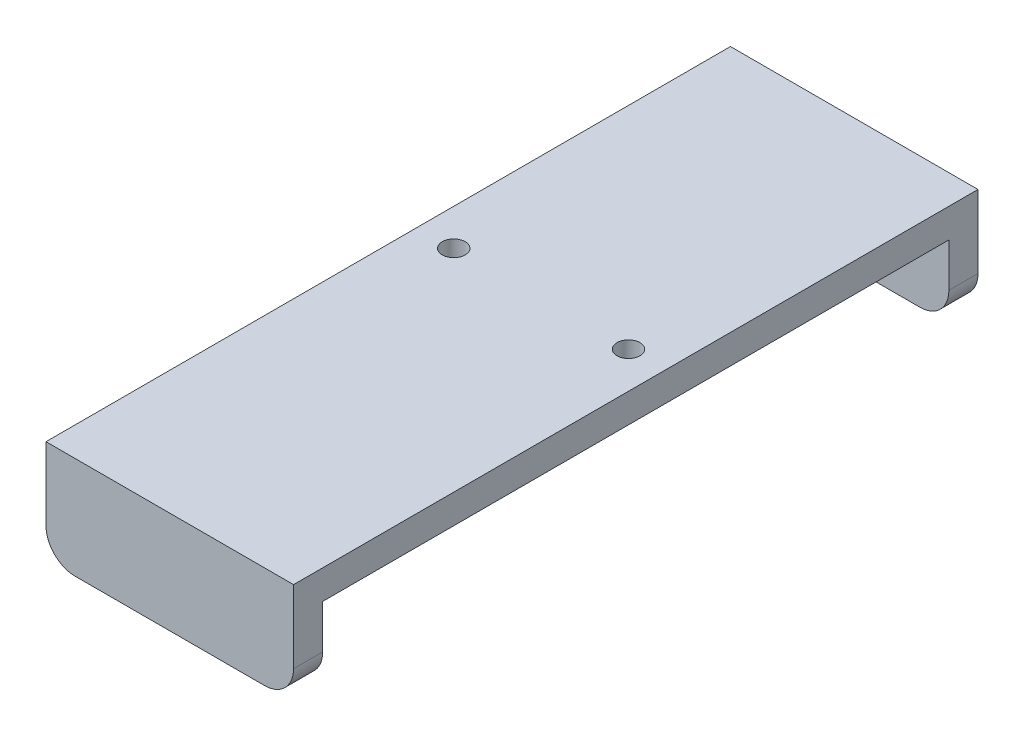
from build123d import *

# Parameters (mm, degrees)
EXTRUDE_THIN1_DEPTH = 21.59
CUT_EXTRUDE1_REACH  = 39.893
SKETCH2_R           = 1
FILLET1_R           = 2.54


with BuildPart() as part:
    # Sketch1 → Extrude-Thin1 (new body)
    with BuildSketch(Plane(origin=(0, 0, 0), x_dir=(0, 0, -1), z_dir=(1, 0, 0))):
        Polygon((-27.305, -6.35), (-27.305, 0), (27.305, 0), (27.305, -6.35), (29.845, -6.35), (29.845, 2.54), (-29.845, 2.54), (-29.845, -6.35), align=None)
    extrude(amount=EXTRUDE_THIN1_DEPTH)

    # Sketch2 → Cut-Extrude1 (cut, up to next)
    with BuildSketch(Plane(origin=(0, 2.54, 0), x_dir=(1, 0, 0), z_dir=(0, 1, 0)), mode=Mode.PRIVATE) as cut_extrude1_sk1:
        with Locations(Location((3.175, 2.54, 0), (0, 0, 270))):
            Circle(SKETCH2_R)
    cut_extrude1_tool1 = extrude(cut_extrude1_sk1.sketch, amount=-CUT_EXTRUDE1_REACH, mode=Mode.PRIVATE) & part.part
    # Sketch2 → Cut-Extrude1 (cut, up to next)
    with BuildSketch(Plane(origin=(0, 2.54, 0), x_dir=(1, 0, 0), z_dir=(0, 1, 0)), mode=Mode.PRIVATE) as cut_extrude1_sk2:
        with Locations(Location((18.415, 2.54, 0), (0, 0, 270))):
            Circle(SKETCH2_R)
    cut_extrude1_tool2 = extrude(cut_extrude1_sk2.sketch, amount=-CUT_EXTRUDE1_REACH, mode=Mode.PRIVATE) & part.part
    add(cut_extrude1_tool1.solids().sort_by_distance((3.175, 2.54, -2.54))[0], mode=Mode.SUBTRACT)
    add(cut_extrude1_tool2.solids().sort_by_distance((18.415, 2.54, -2.54))[0], mode=Mode.SUBTRACT)

    # Fillet1
    fillet1_edges = [part.edges().sort_by_distance(p)[0] for p in [
        (21.59, -6.35, -28.575),
        (21.59, -6.35, 28.575),
        (0, -6.35, -28.575),
        (0, -6.35, 28.575),
    ]]
    fillet(fillet1_edges, radius=FILLET1_R)


solid = part.part
